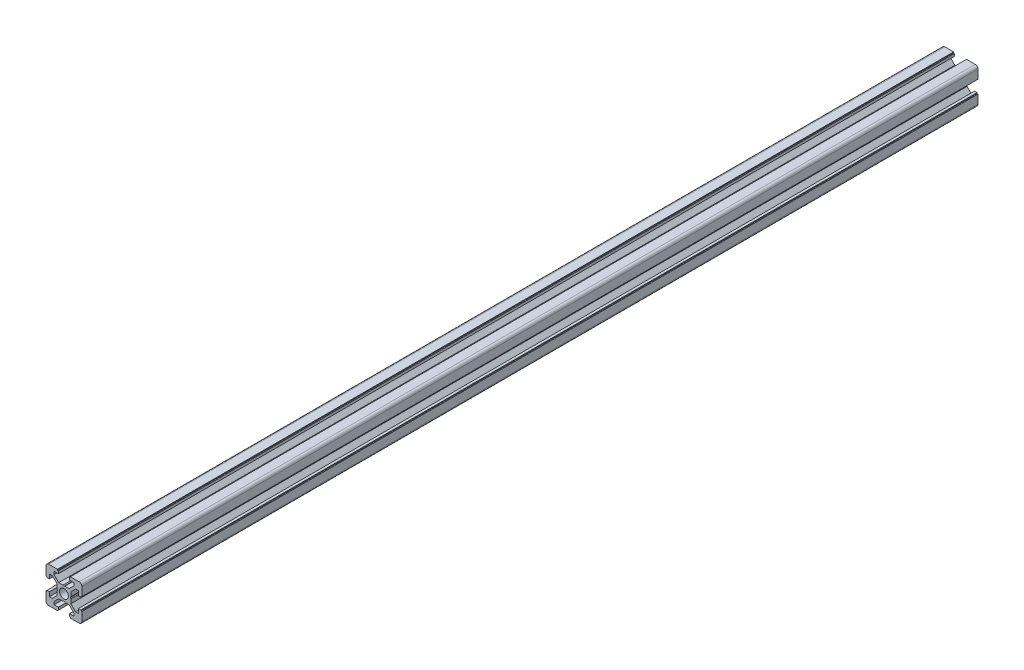
from build123d import *

# Parameters (mm, degrees)
SKETCH_28_R     = 2.5
EXTRUDE_1_DEPTH = 500


with BuildPart() as part:
    # 草图28 → 凸台-拉伸1 (new body)
    with BuildSketch(Plane.XY):
        with BuildLine():
            Line((-3.9, -0.519615242), (-3.9, -2.910050506))
            Line((-3.9, -2.910050506), (-6.489949494, -5.5))
            Line((-6.489949494, -5.5), (-8.1, -5.5))
            Line((-8.1, -5.5), (-8.1, -3.1))
            Line((-8.1, -3.1), (-9.5, -3.1))
            Line((-9.5, -3.1), (-9.5, -3.6))
            Line((-9.5, -3.6), (-10, -3.6))
            Line((-10, -3.6), (-10, -8.5))
            ThreePointArc((-10, -8.5), (-9.560660172, -9.560660172), (-8.5, -10))
            Line((-8.5, -10), (-3.6, -10))
            Line((-3.6, -10), (-3.6, -9.5))
            Line((-3.6, -9.5), (-3.1, -9.5))
            Line((-3.1, -9.5), (-3.1, -8.1))
            Line((-3.1, -8.1), (-5.5, -8.1))
            Line((-5.5, -8.1), (-5.5, -6.489949494))
            Line((-5.5, -6.489949494), (-2.910050506, -3.9))
            Line((-2.910050506, -3.9), (-0.519615242, -3.9))
            Line((-0.519615242, -3.9), (0, -3.6))
            Line((0, -3.6), (0.519615242, -3.9))
            Line((0.519615242, -3.9), (2.910050506, -3.9))
            Line((2.910050506, -3.9), (5.5, -6.489949494))
            Line((5.5, -6.489949494), (5.5, -8.1))
            Line((5.5, -8.1), (3.1, -8.1))
            Line((3.1, -8.1), (3.1, -9.5))
            Line((3.1, -9.5), (3.6, -9.5))
            Line((3.6, -9.5), (3.6, -10))
            Line((3.6, -10), (8.5, -10))
            ThreePointArc((8.5, -10), (9.560660172, -9.560660172), (10, -8.5))
            Line((10, -8.5), (10, -3.6))
            Line((10, -3.6), (9.5, -3.6))
            Line((9.5, -3.6), (9.5, -3.1))
            Line((9.5, -3.1), (8.1, -3.1))
            Line((8.1, -3.1), (8.1, -5.5))
            Line((8.1, -5.5), (6.489949494, -5.5))
            Line((6.489949494, -5.5), (3.9, -2.910050506))
            Line((3.9, -2.910050506), (3.9, -0.519615242))
            Line((3.9, -0.519615242), (3.6, 0))
            Line((3.6, 0), (3.9, 0.519615242))
            Line((3.9, 0.519615242), (3.9, 2.910050506))
            Line((3.9, 2.910050506), (6.489949494, 5.5))
            Line((6.489949494, 5.5), (8.1, 5.5))
            Line((8.1, 5.5), (8.1, 3.1))
            Line((8.1, 3.1), (9.5, 3.1))
            Line((9.5, 3.1), (9.5, 3.6))
            Line((9.5, 3.6), (10, 3.6))
            Line((10, 3.6), (10, 8.5))
            ThreePointArc((10, 8.5), (9.560660172, 9.560660172), (8.5, 10))
            Line((8.5, 10), (3.6, 10))
            Line((3.6, 10), (3.6, 9.5))
            Line((3.6, 9.5), (3.1, 9.5))
            Line((3.1, 9.5), (3.1, 8.1))
            Line((3.1, 8.1), (5.5, 8.1))
            Line((5.5, 8.1), (5.5, 6.489949494))
            Line((5.5, 6.489949494), (2.910050506, 3.9))
            Line((2.910050506, 3.9), (0.519615242, 3.9))
            Line((0.519615242, 3.9), (0, 3.6))
            Line((0, 3.6), (-0.519615242, 3.9))
            Line((-0.519615242, 3.9), (-2.910050506, 3.9))
            Line((-2.910050506, 3.9), (-5.5, 6.489949494))
            Line((-5.5, 6.489949494), (-5.5, 8.1))
            Line((-5.5, 8.1), (-3.1, 8.1))
            Line((-3.1, 8.1), (-3.1, 9.5))
            Line((-3.1, 9.5), (-3.6, 9.5))
            Line((-3.6, 9.5), (-3.6, 10))
            Line((-3.6, 10), (-8.5, 10))
            ThreePointArc((-8.5, 10), (-9.560660172, 9.560660172), (-10, 8.5))
            Line((-10, 8.5), (-10, 3.6))
            Line((-10, 3.6), (-9.5, 3.6))
            Line((-9.5, 3.6), (-9.5, 3.1))
            Line((-9.5, 3.1), (-8.1, 3.1))
            Line((-8.1, 3.1), (-8.1, 5.5))
            Line((-8.1, 5.5), (-6.489949494, 5.5))
            Line((-6.489949494, 5.5), (-3.9, 2.910050506))
            Line((-3.9, 2.910050506), (-3.9, 0.519615242))
            Line((-3.9, 0.519615242), (-3.6, 0))
            Line((-3.6, 0), (-3.9, -0.519615242))
        make_face()
        Circle(SKETCH_28_R, mode=Mode.SUBTRACT)
    extrude(amount=EXTRUDE_1_DEPTH)


solid = part.part
